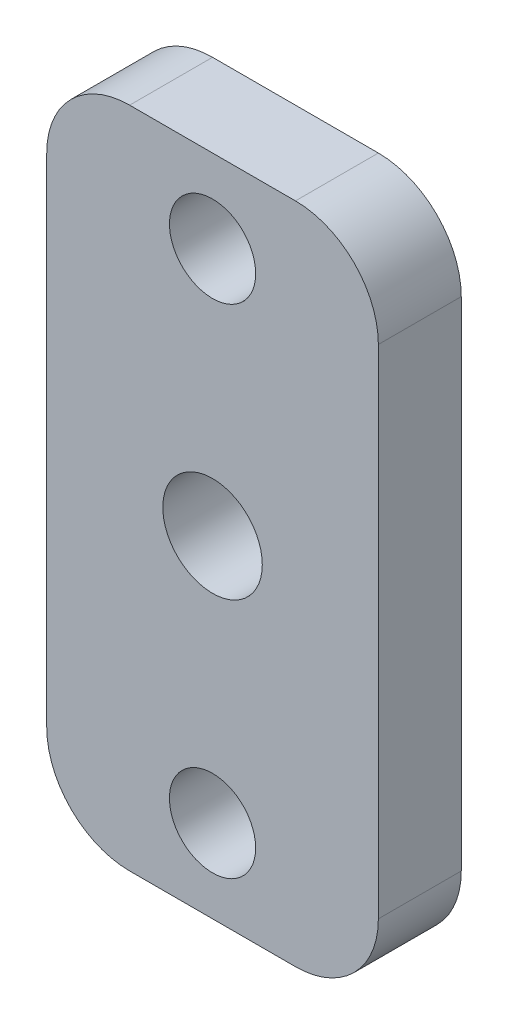
from build123d import *

# Parameters (mm, degrees)
ESBO_O1_W                = 20
ESBO_O1_H                = 40
ESBO_O1_R                = 3
RESSALTO_EXTRUS_O1_DEPTH = 2.5
FILETE1_R                = 5
ESBO_O2_R                = 2.6
CORTE_EXTRUS_O1_DEPTH    = 6


with BuildPart() as part:
    # Esboço1 → Ressalto-extrusão1 (new, symmetric)
    with BuildSketch(Plane.XY):
        Rectangle(ESBO_O1_W, ESBO_O1_H)
        Circle(ESBO_O1_R, mode=Mode.SUBTRACT)
    extrude(amount=RESSALTO_EXTRUS_O1_DEPTH, both=True)

    # Filete1
    filete1_edges = [part.edges().sort_by_distance(p)[0] for p in [
        (10, -20, 0),
        (-10, -20, 0),
        (-10, 20, 0),
        (10, 20, 0),
    ]]
    fillet(filete1_edges, radius=FILETE1_R)

    # Esboço2 → Corte-extrusão1 (cut)
    with BuildSketch(Plane.XY.offset(2.5)):
        with Locations((0, 15)):
            Circle(ESBO_O2_R)
    corte_extrus_o1 = extrude(amount=-CORTE_EXTRUS_O1_DEPTH, mode=Mode.SUBTRACT)

    # Espelhar1: Corte-extrusão1 across plane
    add(corte_extrus_o1.mirror(Plane.ZX), mode=Mode.SUBTRACT)


solid = part.part
